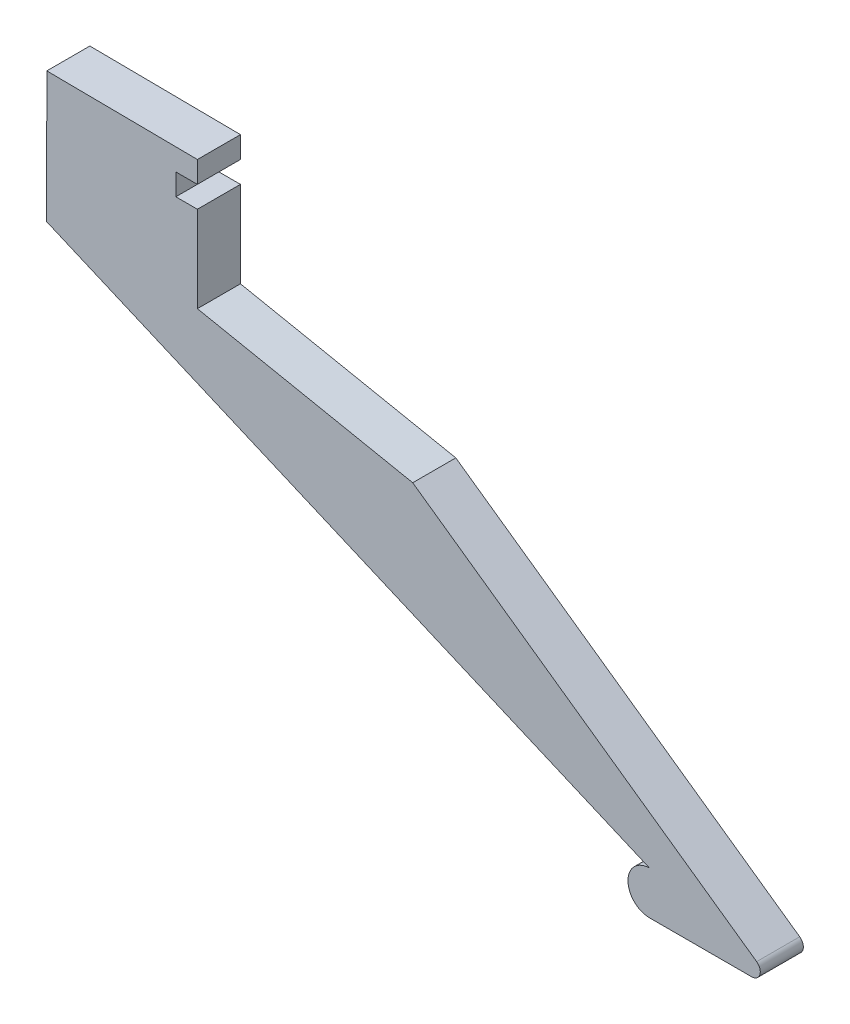
from build123d import *

# Parameters (mm, degrees)
BOSS_EXTRUDE1_DEPTH = 3.175
SKETCH2_W           = 1.5875
SKETCH2_H           = 1.5875
CUT_EXTRUDE1_DEPTH  = 3.175


with BuildPart() as part:
    # Sketch1 → Boss-Extrude1 (new body)
    with BuildSketch(Plane.XY):
        with BuildLine():
            Line((-24.470793716, 23.241427561), (-24.482874985, 13.608728252))
            Line((-24.482874985, 13.608728252), (19.967125015, -5.441271748))
            ThreePointArc((19.967125015, -5.441271748), (18.373232421, -7.022379153), (19.954339827, -8.616271748))
            Line((19.954339827, -8.616271748), (27.492125015, -8.616271748))
            ThreePointArc((27.492125015, -8.616271748), (28.097157471, -8.173526248), (27.858189288, -7.462905352))
            Line((27.858189288, -7.462905352), (2.504625015, 10.433728252))
            Line((2.504625015, 10.433728252), (-13.370374985, 13.608728252))
            Line((-13.370374985, 13.608728252), (-13.370374985, 23.133728252))
            Line((-13.370374985, 23.133728252), (-24.470793716, 23.241427561))
        make_face()
    extrude(amount=BOSS_EXTRUDE1_DEPTH)

    # Sketch2 → Cut-Extrude1 (cut)
    with BuildSketch(Plane.XY.offset(3.175)):
        with Locations((-14.164124985, 20.752478252)):
            Rectangle(SKETCH2_W, SKETCH2_H)
    extrude(amount=-CUT_EXTRUDE1_DEPTH, mode=Mode.SUBTRACT)


solid = part.part
